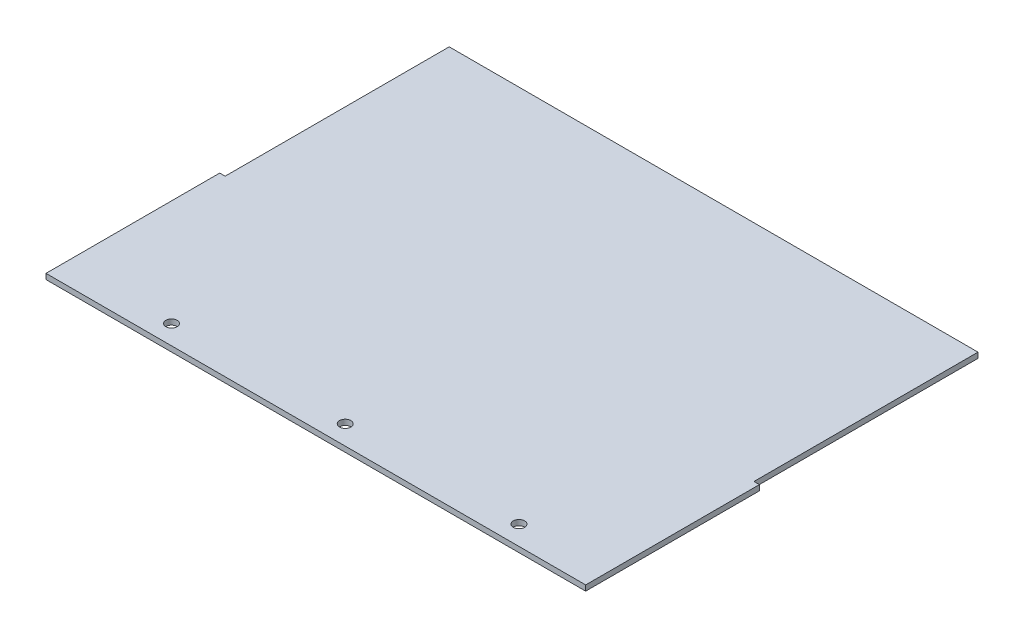
from build123d import *

# Parameters (mm, degrees)
SKETCH1_W           = 315.58
SKETCH1_H           = 3.175
BOSS_EXTRUDE1_DEPTH = 232.600000128
SKETCH5_W           = 3.175
SKETCH5_H           = 130.999992
CUT_EXTRUDE2_DEPTH  = 282.088108579
SKETCH7_R           = 3.302
CUT_EXTRUDE3_DEPTH  = 282.088108579
LPATTERN1_COUNT     = 3
LPATTERN1_PITCH     = 101.6


with BuildPart() as part:
    # Sketch1 → Boss-Extrude1 (new body)
    with BuildSketch(Plane.XY):
        Rectangle(SKETCH1_W, SKETCH1_H)
    extrude(amount=BOSS_EXTRUDE1_DEPTH)

    # Sketch5 → Cut-Extrude2 (cut, symmetric)
    with BuildSketch(Plane(origin=(0, 1.5875, 0), x_dir=(1, 0, 0), z_dir=(0, 1, 0))):
        with Locations((-156.2025, -65.499996)):
            Rectangle(SKETCH5_W, SKETCH5_H)
    cut_extrude2 = extrude(amount=CUT_EXTRUDE2_DEPTH, both=True, mode=Mode.SUBTRACT)

    # Mirror1: Cut-Extrude2 across plane
    add(cut_extrude2.mirror(Plane(origin=(0, 0, 0), x_dir=(0, 0, 1), z_dir=(1, 0, 0))), mode=Mode.SUBTRACT)

    # Sketch7 → Cut-Extrude3 (cut, through all)
    with BuildSketch(Plane.XZ.offset(1.5875)):
        with Locations(Location((107.495393219, 221.30835, 0), (0, 0, 270))):
            Circle(SKETCH7_R)
    cut_extrude3 = extrude(amount=-CUT_EXTRUDE3_DEPTH, mode=Mode.SUBTRACT)

    # LPattern1: Cut-Extrude3 ×3
    with Locations(*[(-i * LPATTERN1_PITCH, 0, 0) for i in range(1, LPATTERN1_COUNT)]):
        add(cut_extrude3, mode=Mode.SUBTRACT)


solid = part.part
